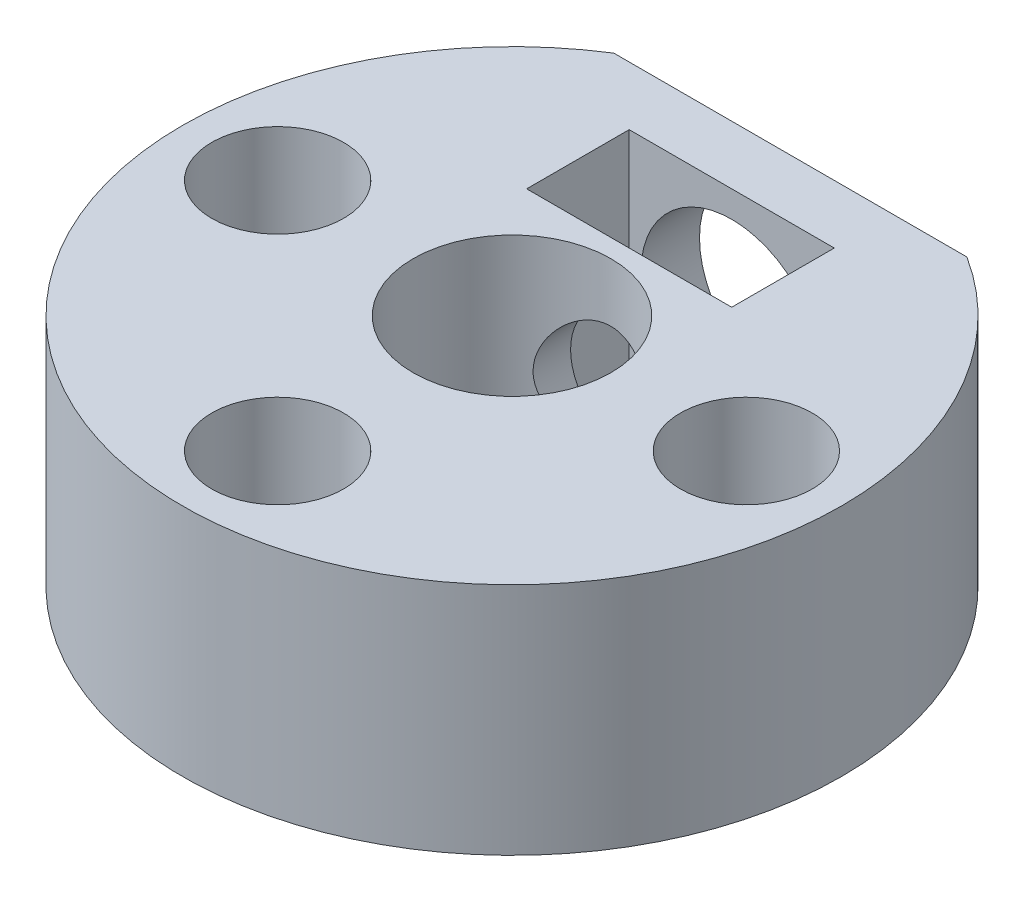
from build123d import *

# Parameters (mm, degrees)
BOSS_EXTRU_1_DEPTH                              = 8
SKETCH1_R                                       = 3.375
CUT_EXTRUDE1_DEPTH                              = 18.808003819
ESQUISSE7_W                                     = 7
ESQUISSE7_H                                     = 3.5
ENL_V_MAT_EXTRU_2_DEPTH                         = 18.808003819
CHAMBRAGE_POUR_VIS_T_TE_CYLINDRIQUE_D           = 2.5
CHAMBRAGE_POUR_VIS_T_TE_CYLINDRIQUE_CBORE_D     = 4.5
CHAMBRAGE_POUR_VIS_T_TE_CYLINDRIQUE_CBORE_DEPTH = 5.3
CBORE_FOR_M5_HEX_HEAD_BOLT1_D                   = 4
CBORE_FOR_M5_HEX_HEAD_BOLT1_DEPTH               = 9.499
CBORE_FOR_M5_HEX_HEAD_BOLT1_CBORE_D             = 6.2
CBORE_FOR_M5_HEX_HEAD_BOLT1_CBORE_DEPTH         = 2
CBORE_FOR_M5_HEX_HEAD_BOLT1_TIP                 = 1.201721238


with BuildPart() as part:
    # Esquisse1 → Boss.-Extru.1 (new body)
    with BuildSketch(Plane(origin=(0, 0, 0), x_dir=(1, 0, 0), z_dir=(0, 1, 0))):
        with BuildLine():
            Line((6.025985397, 9.5), (-6.025985397, 9.5))
            ThreePointArc((-6.025985397, 9.5), (0, -11.25), (6.025985397, 9.5))
        make_face()
    extrude(amount=BOSS_EXTRU_1_DEPTH)

    # Sketch1 → Cut-Extrude1 (cut, through all)
    with BuildSketch(Plane(origin=(0, 8, 0), x_dir=(1, 0, 0), z_dir=(0, 1, 0))):
        with Locations(Location((0, 0, 0), (0, 0, 270))):
            Circle(SKETCH1_R)
    extrude(amount=-CUT_EXTRUDE1_DEPTH, mode=Mode.SUBTRACT)

    # Esquisse7 → Enlèv. mat.-Extru.2 (cut, through all)
    with BuildSketch(Plane(origin=(0, 8, 0), x_dir=(1, 0, 0), z_dir=(0, 1, 0))):
        with Locations((0, 5.75)):
            Rectangle(ESQUISSE7_W, ESQUISSE7_H)
    extrude(amount=-ENL_V_MAT_EXTRU_2_DEPTH, mode=Mode.SUBTRACT)

    # Chambrage pour vis à tête cylindrique à 6 pans creux (ou vis CHC) M21 (through all)
    with Locations(Plane(origin=(0, 8, 0), x_dir=(1, 0, 0), z_dir=(0, 1, 0))):
        with Locations((-8, 0), (0, -8), (8, 0)):
            CounterBoreHole(CHAMBRAGE_POUR_VIS_T_TE_CYLINDRIQUE_D / 2, CHAMBRAGE_POUR_VIS_T_TE_CYLINDRIQUE_CBORE_D / 2, CHAMBRAGE_POUR_VIS_T_TE_CYLINDRIQUE_CBORE_DEPTH)

    # CBORE for M5 Hex Head Bolt1
    with Locations(Plane(origin=(0, 0, -9.5), x_dir=(-1, 0, 0), z_dir=(0, 0, -1))):
        with Locations((0, 4)):
            CounterBoreHole(CBORE_FOR_M5_HEX_HEAD_BOLT1_D / 2, CBORE_FOR_M5_HEX_HEAD_BOLT1_CBORE_D / 2, CBORE_FOR_M5_HEX_HEAD_BOLT1_CBORE_DEPTH, depth=CBORE_FOR_M5_HEX_HEAD_BOLT1_DEPTH)
            with Locations((0, 0, -(CBORE_FOR_M5_HEX_HEAD_BOLT1_DEPTH + CBORE_FOR_M5_HEX_HEAD_BOLT1_TIP / 2))):  # 118° drill point
                Cone(0, CBORE_FOR_M5_HEX_HEAD_BOLT1_D / 2, CBORE_FOR_M5_HEX_HEAD_BOLT1_TIP, mode=Mode.SUBTRACT)


solid = part.part
